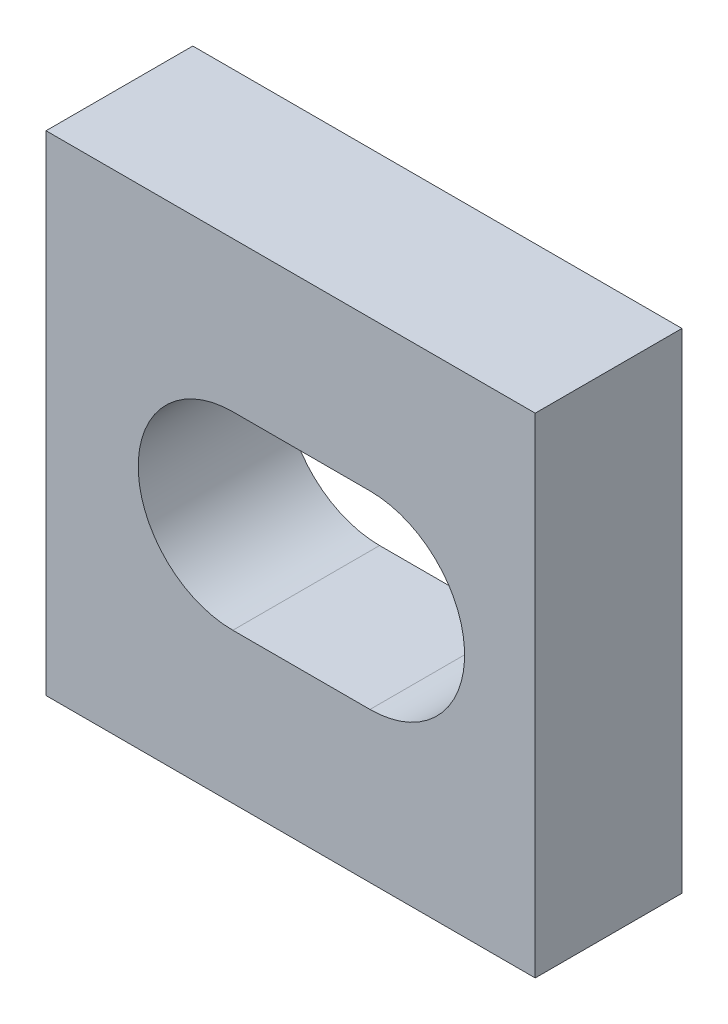
from build123d import *

# Parameters (mm, degrees)
SKETCH_1_W      = 10
SKETCH_1_H      = 10
EXTRUDE_1_DEPTH = 3


with BuildPart() as part:
    # 草图1 → 凸台-拉伸1 (new body)
    with BuildSketch(Plane.XY):
        with Locations((5, -5)):
            Rectangle(SKETCH_1_W, SKETCH_1_H)
        with BuildLine():
            Line((3.81846847, -3.065761471), (6.622313707, -3.065761471))
            ThreePointArc((6.622313707, -3.065761471), (8.556552237, -5), (6.622313707, -6.934238529))
            Line((6.622313707, -6.934238529), (3.81846847, -6.934238529))
            ThreePointArc((3.81846847, -6.934238529), (1.884229941, -5), (3.81846847, -3.065761471))
        make_face(mode=Mode.SUBTRACT)
    extrude(amount=EXTRUDE_1_DEPTH)


solid = part.part
